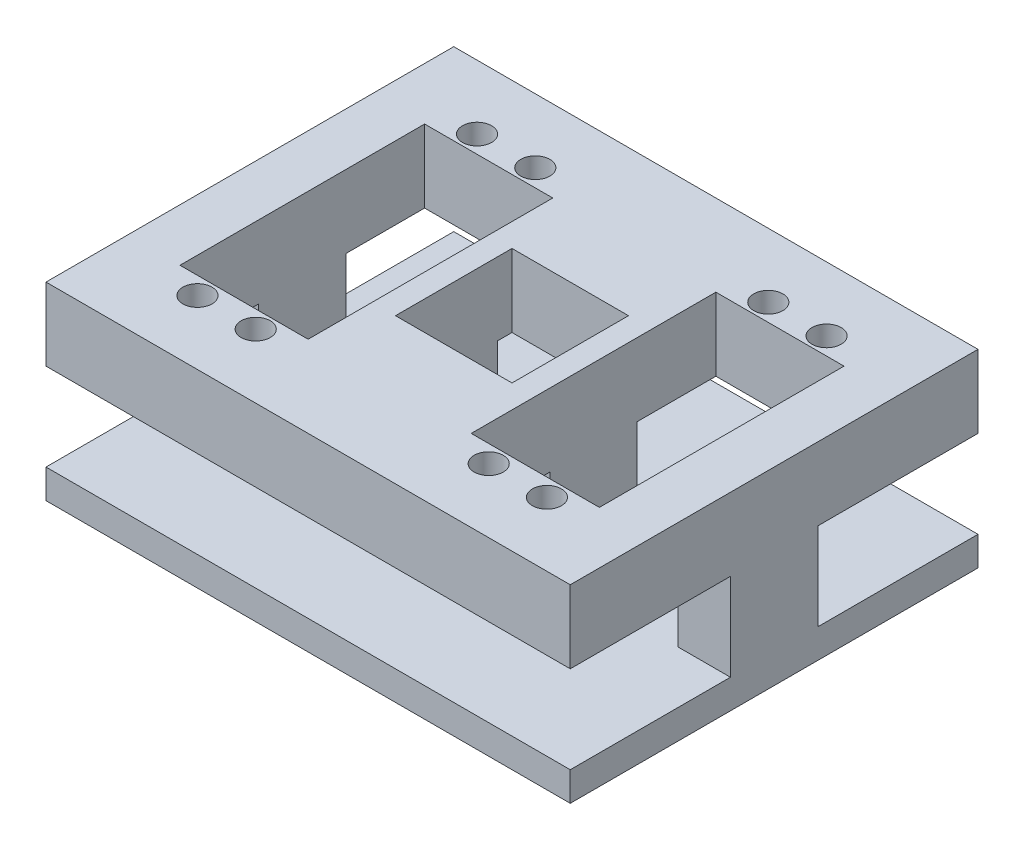
from build123d import *

# Parameters (mm, degrees)
SKETCH1_W           = 90
SKETCH1_H           = 70
SKETCH1_R           = 2.5
SKETCH1_W_2         = 22
SKETCH1_H_2         = 42
BOSS_EXTRUDE1_DEPTH = 12.5
SKETCH3_W           = 9
SKETCH3_H           = 15
SKETCH3_W_2         = 28
BOSS_EXTRUDE2_DEPTH = 15
SKETCH4_W           = 20
SKETCH4_H           = 20
CUT_EXTRUDE1_DEPTH  = 64.294944506
SKETCH7_W           = 90
SKETCH7_H           = 70
SKETCH7_W_2         = 20
SKETCH7_H_2         = 20
BOSS_EXTRUDE3_DEPTH = 5
SKETCH8_R           = 26.514354508
SKETCH8_R_2         = 2.5
BOSS_EXTRUDE4_DEPTH = 5


with BuildPart() as part:
    # Sketch1 → Boss-Extrude1 (new body)
    with BuildSketch(Plane(origin=(0, 0, 0), x_dir=(1, 0, 0), z_dir=(0, 1, 0))):
        Rectangle(SKETCH1_W, SKETCH1_H)
        with Locations(Location((-30, 24, 0), (0, 0, 270))):
            Circle(SKETCH1_R, mode=Mode.SUBTRACT)
        with Locations(Location((-20, 24, 0), (0, 0, 270))):
            Circle(SKETCH1_R, mode=Mode.SUBTRACT)
        with Locations(Location((-20, -24, 0), (0, 0, 90))):
            Circle(SKETCH1_R, mode=Mode.SUBTRACT)
        with Locations(Location((-30, -24, 0), (0, 0, 90))):
            Circle(SKETCH1_R, mode=Mode.SUBTRACT)
        with Locations(Location((20, -24, 0), (0, 0, 270))):
            Circle(SKETCH1_R, mode=Mode.SUBTRACT)
        with Locations(Location((30, -24, 0), (0, 0, 270))):
            Circle(SKETCH1_R, mode=Mode.SUBTRACT)
        with Locations(Location((20, 24, 0), (0, 0, 90))):
            Circle(SKETCH1_R, mode=Mode.SUBTRACT)
        with Locations(Location((30, 24, 0), (0, 0, 90))):
            Circle(SKETCH1_R, mode=Mode.SUBTRACT)
        with Locations((-25, 0)):
            Rectangle(SKETCH1_W_2, SKETCH1_H_2, mode=Mode.SUBTRACT)
        with Locations((25, 0)):
            Rectangle(SKETCH1_W_2, SKETCH1_H_2, mode=Mode.SUBTRACT)
    extrude(amount=BOSS_EXTRUDE1_DEPTH)

    # Sketch3 → Boss-Extrude2 (add)
    with BuildSketch(Plane.XZ):
        with Locations((-40.5, 0)):
            Rectangle(SKETCH3_W, SKETCH3_H)
        Rectangle(SKETCH3_W_2, SKETCH3_H)
        with Locations((40.5, 0)):
            Rectangle(SKETCH3_W, SKETCH3_H)
    extrude(amount=BOSS_EXTRUDE2_DEPTH)

    # Sketch4 → Cut-Extrude1 (cut, through all)
    with BuildSketch(Plane(origin=(0, 12.5, 0), x_dir=(1, 0, 0), z_dir=(0, 1, 0))):
        Rectangle(SKETCH4_W, SKETCH4_H)
    extrude(amount=-CUT_EXTRUDE1_DEPTH, mode=Mode.SUBTRACT)

    # Sketch7 → Boss-Extrude3 (add)
    with BuildSketch(Plane.XZ.offset(15)):
        Rectangle(SKETCH7_W, SKETCH7_H)
        Rectangle(SKETCH7_W_2, SKETCH7_H_2, mode=Mode.SUBTRACT)
    extrude(amount=BOSS_EXTRUDE3_DEPTH)

    # Sketch8 → Boss-Extrude4 (add)
    with BuildSketch(Plane.XZ.offset(20)):
        with Locations(Location((0, 0, 0), (0, 0, 270))):
            Circle(SKETCH8_R)
        with Locations(Location((0, 0, 0), (0, 0, 270))):
            Circle(SKETCH8_R_2, mode=Mode.SUBTRACT)
    extrude(amount=BOSS_EXTRUDE4_DEPTH)


solid = part.part
